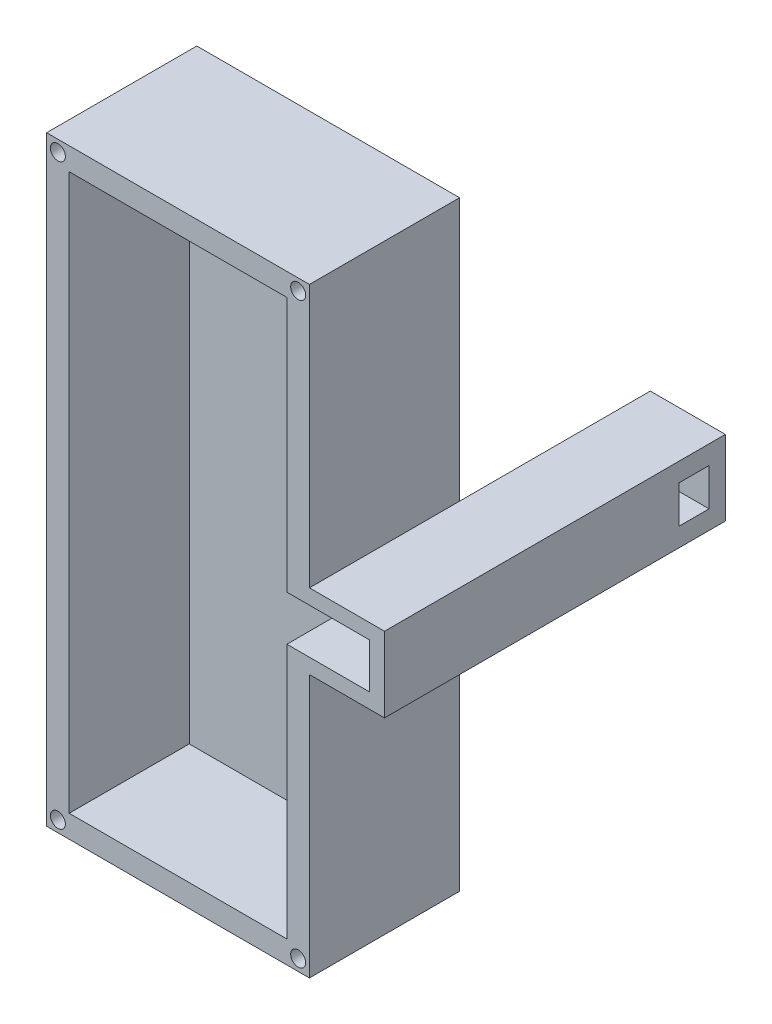
from build123d import *

# Parameters (mm, degrees)
SKETCH1_W           = 35
SKETCH1_H           = 80
BOSS_EXTRUDE1_DEPTH = 20
BOSS_EXTRUDE2_DEPTH = 10
SKETCH3_W           = 6
SKETCH3_H           = 6
CUT_EXTRUDE2_DEPTH  = 39.37
SKETCH6_W           = 4
SKETCH6_H           = 5
CUT_EXTRUDE4_DEPTH  = 5
SKETCH7_W           = 29
SKETCH7_H           = 74
CUT_EXTRUDE5_DEPTH  = 16
SKETCH11_W          = 12.542842321
SKETCH11_H          = 6
CUT_EXTRUDE8_DEPTH  = 16
BOSS_EXTRUDE3_DEPTH = 10
FILLET5_R           = 2.2
SKETCH13_W          = 7
SKETCH13_H          = 18
BOSS_EXTRUDE4_DEPTH = 8
SKETCH14_W          = 2
SKETCH14_H          = 12.5
CUT_EXTRUDE9_DEPTH  = 54.114593098
SKETCH15_W          = 2
SKETCH15_H          = 12.5
CUT_EXTRUDE10_DEPTH = 54.114593098
SKETCH16_W          = 16
SKETCH16_H          = 6
CUT_EXTRUDE11_DEPTH = 10
SKETCH17_W          = 16
SKETCH17_H          = 6
BOSS_EXTRUDE5_DEPTH = 2
SKETCH18_W          = 6
SKETCH18_H          = 6
CUT_EXTRUDE12_DEPTH = 19
SKETCH19_R          = 1
CUT_EXTRUDE13_DEPTH = 3


with BuildPart() as part:
    # Sketch1 → Boss-Extrude1 (new body)
    with BuildSketch(Plane.XY):
        Rectangle(SKETCH1_W, SKETCH1_H)
    extrude(amount=BOSS_EXTRUDE1_DEPTH)

    # Sketch7 → Cut-Extrude5 (cut)
    with BuildSketch(Plane.XY.offset(20)):
        Rectangle(SKETCH7_W, SKETCH7_H)
    extrude(amount=-CUT_EXTRUDE5_DEPTH, mode=Mode.SUBTRACT)



with BuildPart() as body_2:
    # Sketch2 → Boss-Extrude2 (new body)
    with BuildSketch(Plane(origin=(17.5, 0, 0), x_dir=(0, 0, -1), z_dir=(1, 0, 0))):
        Polygon((0, 5), (25.4, 5), (25.4, -5), (0, -5), (-20, -5), (-20, 5), align=None)
    extrude(amount=BOSS_EXTRUDE2_DEPTH)

    # Sketch3 → Cut-Extrude2 (cut)
    with BuildSketch(Plane.XY.offset(20)):
        with Locations((22.5, 0)):
            Rectangle(SKETCH3_W, SKETCH3_H)
    extrude(amount=-CUT_EXTRUDE2_DEPTH, mode=Mode.SUBTRACT)

    # Sketch6 → Cut-Extrude4 (cut)
    with BuildSketch(Plane(origin=(27.5, 0, 0), x_dir=(0, 0, -1), z_dir=(1, 0, 0))):
        with Locations((21.230369208, 0)):
            Rectangle(SKETCH6_W, SKETCH6_H)
    extrude(amount=-CUT_EXTRUDE4_DEPTH, mode=Mode.SUBTRACT)

    # Sketch11 → Cut-Extrude8 (cut)
    with BuildSketch(Plane.XY.offset(20)):
        with Locations((25.771421161, 0)):
            Rectangle(SKETCH11_W, SKETCH11_H)
    extrude(amount=-CUT_EXTRUDE8_DEPTH, mode=Mode.SUBTRACT)


with BuildPart() as part_1:
    add(part.part)

    add(body_2.part)  # Boss-Extrude3 merges body 2
    # Sketch12 → Boss-Extrude3 (add)
    with BuildSketch(Plane.XZ.offset(5)):
        with BuildLine():
            Line((26.553770823, 0), (17.5, 0))
            Line((17.5, 0), (17.5, -4.56807309))
            ThreePointArc((17.5, -4.56807309), (24.455433698, -7.097339482), (26.553770823, 0))
        make_face()
    extrude(amount=-BOSS_EXTRUDE3_DEPTH)

    # Fillet5
    fillet5_edges = [part_1.edges().sort_by_distance(p)[0] for p in [
        (22.5, 0, -19.37),
    ]]
    fillet(fillet5_edges, radius=FILLET5_R)

    # Sketch13 → Boss-Extrude4 (add)
    with BuildSketch(Plane(origin=(0, 0, 0), x_dir=(-1, 0, 0), z_dir=(0, 0, -1))):
        with Locations((0, 20)):
            Rectangle(SKETCH13_W, SKETCH13_H)
        with Locations((0, -20)):
            Rectangle(SKETCH13_W, SKETCH13_H)
    extrude(amount=BOSS_EXTRUDE4_DEPTH)

    # Sketch14 → Cut-Extrude9 (cut, through all)
    with BuildSketch(Plane(origin=(3.5, 0, 0), x_dir=(0, 0, -1), z_dir=(1, 0, 0))):
        with Locations((4.000507047, 20.000395676)):
            Rectangle(SKETCH14_W, SKETCH14_H)
    extrude(amount=-CUT_EXTRUDE9_DEPTH, mode=Mode.SUBTRACT)

    # Sketch15 → Cut-Extrude10 (cut, through all)
    with BuildSketch(Plane(origin=(3.5, 0, 0), x_dir=(0, 0, -1), z_dir=(1, 0, 0))):
        with Locations((3.99995913, -20.00010798)):
            Rectangle(SKETCH15_W, SKETCH15_H)
    extrude(amount=-CUT_EXTRUDE10_DEPTH, mode=Mode.SUBTRACT)

    # Sketch16 → Cut-Extrude11 (cut)
    with BuildSketch(Plane(origin=(19.5, 0, 0), x_dir=(0, 0, -1), z_dir=(1, 0, 0))):
        with Locations((-12, 0)):
            Rectangle(SKETCH16_W, SKETCH16_H)
    extrude(amount=-CUT_EXTRUDE11_DEPTH, mode=Mode.SUBTRACT)

    # Sketch17 → Boss-Extrude5 (add)
    with BuildSketch(Plane.ZY.offset(-25.5)):
        with Locations((12, 0)):
            Rectangle(SKETCH17_W, SKETCH17_H)
    extrude(amount=-BOSS_EXTRUDE5_DEPTH)

    # Sketch18 → Cut-Extrude12 (cut)
    with BuildSketch(Plane.XY):
        with Locations((22.5, 0)):
            Rectangle(SKETCH18_W, SKETCH18_H)
    extrude(amount=-CUT_EXTRUDE12_DEPTH, mode=Mode.SUBTRACT)

    # Sketch19 → Cut-Extrude13 (cut)
    with BuildSketch(Plane.XY.offset(20)):
        with Locations((16, 38.5)):
            Circle(SKETCH19_R)
        with Locations((-16, 38.5)):
            Circle(SKETCH19_R)
        with Locations((16, -38.5)):
            Circle(SKETCH19_R)
        with Locations((-16, -38.5)):
            Circle(SKETCH19_R)
    extrude(amount=-CUT_EXTRUDE13_DEPTH, mode=Mode.SUBTRACT)


solid = part_1.part
